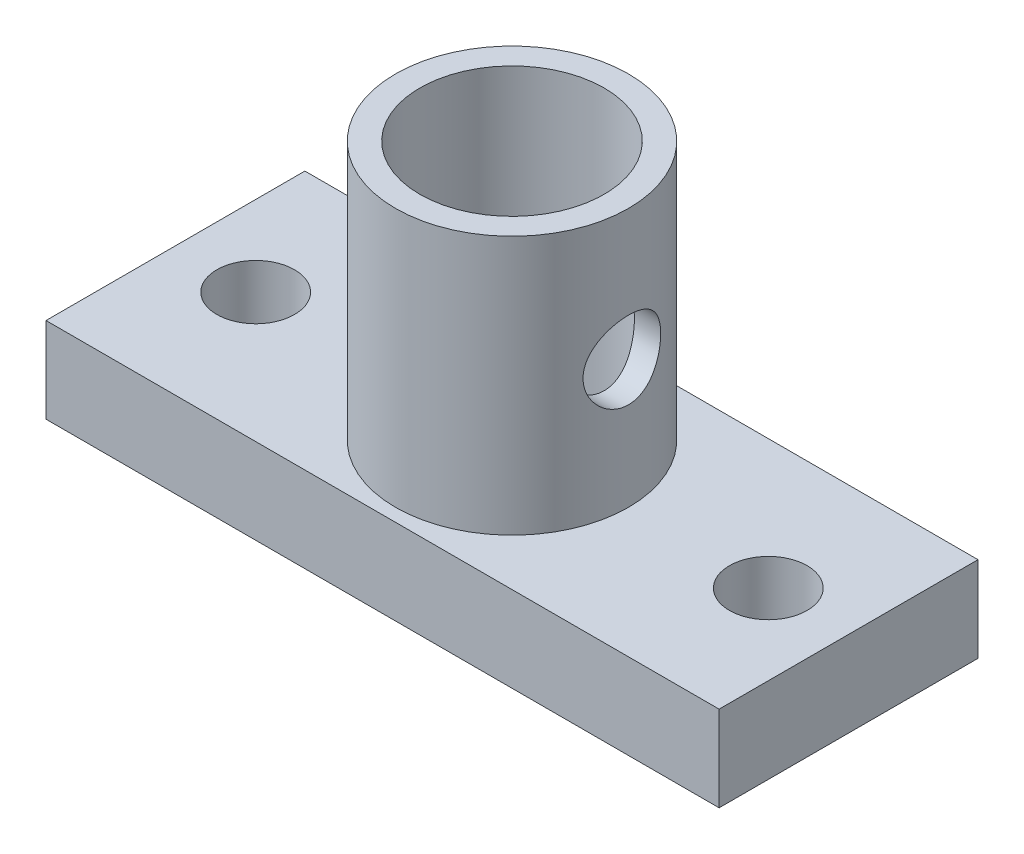
from build123d import *

# Parameters (mm, degrees)
SKETCH1_W             = 26
SKETCH1_H             = 10
SKETCH1_R             = 1.5
BOSS_EXTRUDE5_DEPTH   = 3.302
SKETCH5_R             = 4.5
SKETCH5_R_2           = 3.56
BOSS_EXTRUDE7_DEPTH   = 10
SKETCH7_R             = 1.5
CUT_EXTRUDE1_DEPTH    = 10
CORTAR_EXTRUIR1_START = -10
CROQUIS1_R            = 3.56
CORTAR_EXTRUIR1_DEPTH = 10


with BuildPart() as part:
    # Sketch1 → Boss-Extrude5 (new body)
    with BuildSketch(Plane(origin=(0, 0, 0), x_dir=(1, 0, 0), z_dir=(0, 1, 0))):
        Rectangle(SKETCH1_W, SKETCH1_H)
        with Locations(Location((-9.9, 0, 0), (0, 0, 90))):
            Circle(SKETCH1_R, mode=Mode.SUBTRACT)
        with Locations(Location((9.9, 0, 0), (0, 0, 90))):
            Circle(SKETCH1_R, mode=Mode.SUBTRACT)
    extrude(amount=BOSS_EXTRUDE5_DEPTH)

    # Sketch5 → Boss-Extrude7 (add)
    with BuildSketch(Plane(origin=(0, 3.302, 0), x_dir=(1, 0, 0), z_dir=(0, 1, 0))):
        with Locations(Location((0, 0, 0), (0, 0, 90))):
            Circle(SKETCH5_R)
        with Locations(Location((0, 0, 0), (0, 0, 270))):
            Circle(SKETCH5_R_2, mode=Mode.SUBTRACT)
    extrude(amount=BOSS_EXTRUDE7_DEPTH)

    # Sketch7 → Cut-Extrude1 (cut)
    with BuildSketch(Plane(origin=(0, 0, 0), x_dir=(0, 0, -1), z_dir=(1, 0, 0))):
        with Locations(Location((0, 8.232726323, 0), (0, 0, 180))):
            Circle(SKETCH7_R)
    extrude(amount=CUT_EXTRUDE1_DEPTH, mode=Mode.SUBTRACT)

    # Croquis1 → Cortar-Extruir1 (cut)
    with BuildSketch(Plane(origin=(0, 3.302, 0), x_dir=(1, 0, 0), z_dir=(0, 1, 0)).offset(CORTAR_EXTRUIR1_START)):
        with Locations(Location((0, 0, 0), (0, 0, 90))):
            Circle(CROQUIS1_R)
    extrude(amount=CORTAR_EXTRUIR1_DEPTH, mode=Mode.SUBTRACT)


solid = part.part
